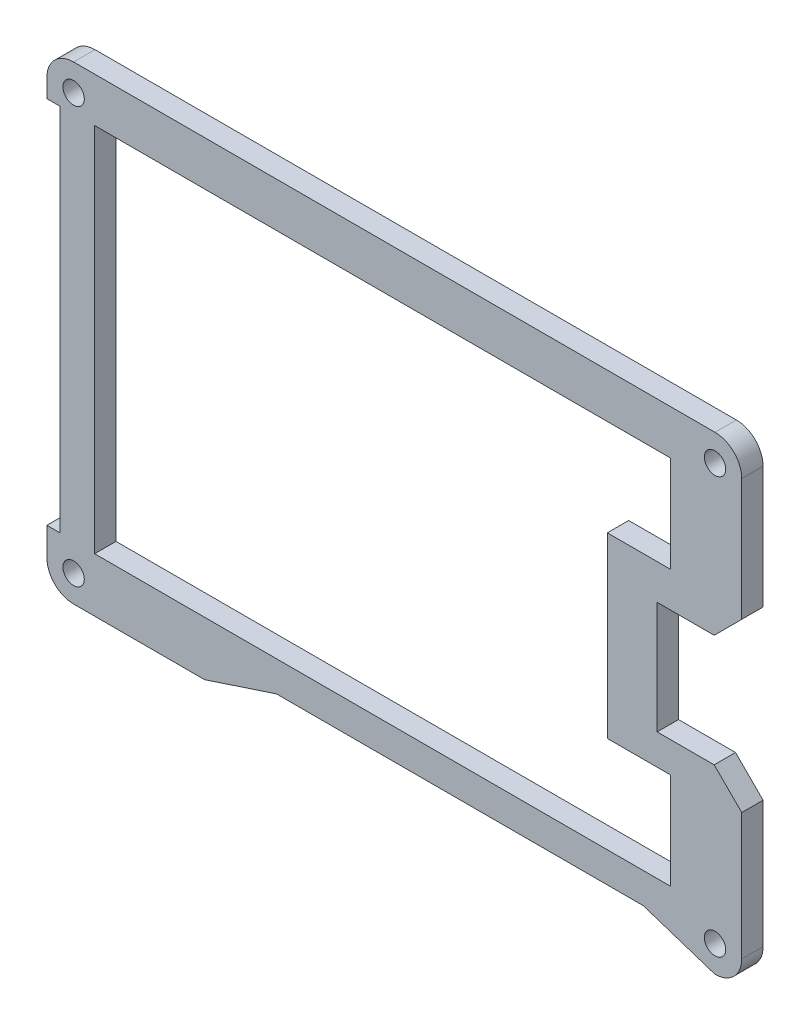
from build123d import *

# Parameters (mm, degrees)
BOSS_EXTRUDE1_DEPTH = 3.048
SKETCH2_R           = 1.355900406
CUT_EXTRUDE1_DEPTH  = 430.898988368
SKETCH3_R           = 1.524
CUT_EXTRUDE2_DEPTH  = 430.898988368
CUT_EXTRUDE3_DEPTH  = 430.898988368
BOSS_EXTRUDE2_DEPTH = 3.048
SKETCH5_W           = 73.1256
SKETCH5_H           = 52.8987
SKETCH5_W_2         = 9.017
SKETCH5_H_2         = 13.74935
CUT_EXTRUDE4_DEPTH  = 430.898988368


with BuildPart() as part:
    # Sketch1 → Boss-Extrude1 (new body)
    with BuildSketch(Plane.XY):
        with BuildLine():
            Line((-309.8086, 128.8851), (-305.87795, 128.8851))
            Line((-305.87795, 128.8851), (-301.9473, 132.81575))
            Line((-301.9473, 132.81575), (-301.9473, 150.9704))
            ThreePointArc((-301.9473, 150.9704), (-303.063223164, 153.664476836), (-305.7573, 154.7804))
            Line((-305.7573, 154.7804), (-397.247125, 154.7804))
            ThreePointArc((-397.247125, 154.7804), (-399.946077222, 153.659592612), (-401.0571, 150.956597849))
            Line((-401.0571, 150.956597849), (-401.0571, 148.341))
            Line((-401.0571, 148.341), (-399.1521, 148.341))
            Line((-399.1521, 148.341), (-399.1521, 95.6449))
            Line((-399.1521, 95.6449), (-401.0571, 95.6449))
            Line((-401.0571, 95.6449), (-401.0571, 91.659304166))
            ThreePointArc((-401.0571, 91.659304166), (-399.951018769, 88.947400452), (-397.2472, 87.8217))
            Line((-397.2472, 87.8217), (-378.5565, 87.8217))
            Line((-378.5565, 87.8217), (-368.3165, 91.1883))
            Line((-368.3165, 91.1883), (-315.9973, 91.1883))
            Line((-315.9973, 91.1883), (-305.7573, 87.8217))
            ThreePointArc((-305.7573, 87.8217), (-303.063223164, 88.937623164), (-301.9473, 91.6317))
            Line((-301.9473, 91.6317), (-301.9473, 111.74645))
            Line((-301.9473, 111.74645), (-305.87795, 115.6771))
            Line((-305.87795, 115.6771), (-309.8086, 115.6771))
            Line((-309.8086, 115.6771), (-314.0123, 115.6771))
            Line((-314.0123, 115.6771), (-314.0123, 128.8851))
            Line((-314.0123, 128.8851), (-309.8086, 128.8851))
        make_face()
        Polygon((-395.3675, 92.9525), (-395.3675, 149.2432), (-309.8086, 149.2432), (-309.8086, 132.81575), (-318.2033, 132.81575), (-318.2033, 111.74645), (-309.8086, 111.74645), (-309.8086, 92.9525), align=None, mode=Mode.SUBTRACT)
    extrude(amount=BOSS_EXTRUDE1_DEPTH)

    # Sketch2 → Cut-Extrude1 (cut, through all)
    with BuildSketch(Plane(origin=(0, 0, 0), x_dir=(-1, 0, 0), z_dir=(0, 0, -1))):
        with Locations((305.7573, 150.9704)):
            Circle(SKETCH2_R)
        with Locations((397.247125, 150.9704)):
            Circle(SKETCH2_R)
        with Locations((397.2472, 91.6317)):
            Circle(SKETCH2_R)
        with Locations((305.7573, 91.6317)):
            Circle(SKETCH2_R)
    extrude(amount=-CUT_EXTRUDE1_DEPTH, mode=Mode.SUBTRACT)

    # Sketch3 → Cut-Extrude2 (cut, through all)
    with BuildSketch(Plane(origin=(0, 0, 0), x_dir=(-1, 0, 0), z_dir=(0, 0, -1))):
        with Locations((305.7573, 150.9704)):
            Circle(SKETCH3_R)
        with Locations((397.247125, 150.9704)):
            Circle(SKETCH3_R)
        with Locations((397.2472, 91.6317)):
            Circle(SKETCH3_R)
        with Locations((305.7573, 91.6317)):
            Circle(SKETCH3_R)
    extrude(amount=-CUT_EXTRUDE2_DEPTH, mode=Mode.SUBTRACT)

    # Sketch4 → Cut-Extrude3 (cut, through all)
    with BuildSketch(Plane.XY.offset(3.048)):
        Polygon((-301.9473, 133.57775), (-305.87795, 129.6471), (-314.0123, 129.6471), (-314.0123, 113.6451), (-305.87795, 113.6451), (-301.9473, 109.71445), align=None)
    extrude(amount=-CUT_EXTRUDE3_DEPTH, mode=Mode.SUBTRACT)

    # Sketch4<4> → Boss-Extrude2 (add)
    with BuildSketch(Plane.XY.offset(3.048)):
        Polygon((-318.2033, 111.74645), (-318.2033, 132.81575), (-309.8086, 132.81575), (-309.8086, 149.2432), (-395.3675, 149.2432), (-395.3675, 92.9525), (-309.8086, 92.9525), (-309.8086, 111.74645), align=None)
    extrude(amount=-BOSS_EXTRUDE2_DEPTH)

    # Sketch5 → Cut-Extrude4 (cut, through all)
    with BuildSketch(Plane.XY.offset(3.048)):
        with Locations((-357.6871, 121.98105)):
            Rectangle(SKETCH5_W, SKETCH5_H)
        with Locations((-316.6158, 141.555725)):
            Rectangle(SKETCH5_W_2, SKETCH5_H_2)
        with Locations((-316.6158, 102.406375)):
            Rectangle(SKETCH5_W_2, SKETCH5_H_2)
    extrude(amount=-CUT_EXTRUDE4_DEPTH, mode=Mode.SUBTRACT)


solid = part.part
